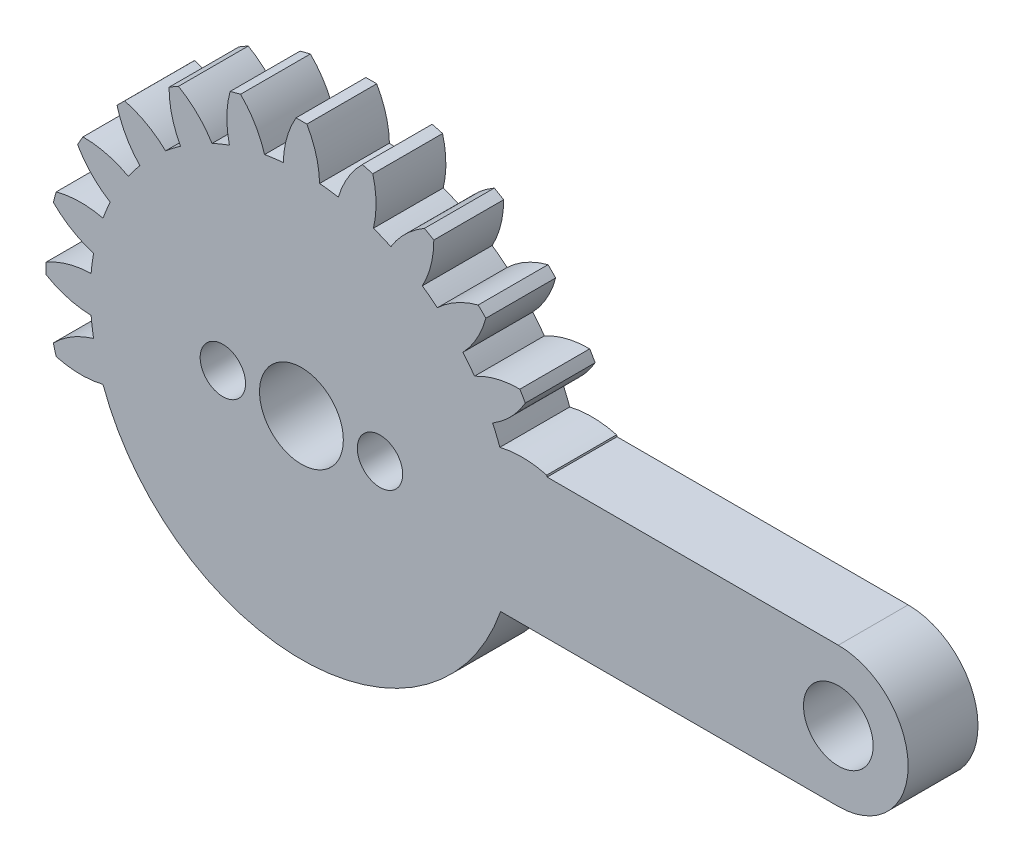
from build123d import *

# Parameters (mm, degrees)
SKETCH2_R           = 1.75
SKETCH2_R_2         = 1.995
BOSS_EXTRUDE1_DEPTH = 4
SKETCH4_R           = 1.3
SKETCH4_R_2         = 2.4
CUT_EXTRUDE1_DEPTH  = 38.915688046


with BuildPart() as part:
    # Sketch2 → Boss-Extrude1 (new body)
    with BuildSketch(Plane.XY):
        with BuildLine():
            ThreePointArc((30.75, -4), (34.75, 0), (30.75, 4))
            Line((30.75, 4), (14.072558403, 4))
            ThreePointArc((14.072558403, 4), (14.06038767, 4.04257326), (14.048088143, 4.085109489))
            ThreePointArc((14.048088143, 4.085109489), (12.709169027, 4.272836063), (11.365584201, 4.122086336))
            ThreePointArc((11.365584201, 4.122086336), (11.169703548, 4.626642697), (10.951436862, 5.12192646))
            ThreePointArc((10.951436862, 5.12192646), (12.008090957, 5.965388247), (12.82210701, 7.044889767))
            ThreePointArc((12.82210701, 7.044889767), (12.669951657, 7.315), (12.51210701, 7.581825517))
            ThreePointArc((12.51210701, 7.581825517), (11.170223244, 7.416617696), (9.911436862, 6.9232593))
            ThreePointArc((9.911436862, 6.9232593), (9.591641884, 7.359925677), (9.252623584, 7.781841479))
            ThreePointArc((9.252623584, 7.781841479), (10.05496909, 8.870045207), (10.561852666, 10.123446462))
            ThreePointArc((10.561852666, 10.123446462), (10.344972209, 10.344972209), (10.123446462, 10.561852666))
            ThreePointArc((10.123446462, 10.561852666), (8.870045207, 10.05496909), (7.781841479, 9.252623584))
            ThreePointArc((7.781841479, 9.252623584), (7.359925677, 9.591641884), (6.9232593, 9.911436862))
            ThreePointArc((6.9232593, 9.911436862), (7.416617696, 11.170223244), (7.581825517, 12.51210701))
            ThreePointArc((7.581825517, 12.51210701), (7.315, 12.669951657), (7.044889767, 12.82210701))
            ThreePointArc((7.044889767, 12.82210701), (5.965388247, 12.008090957), (5.12192646, 10.951436862))
            ThreePointArc((5.12192646, 10.951436862), (4.626642697, 11.169703548), (4.122086336, 11.365584201))
            ThreePointArc((4.122086336, 11.365584201), (4.272836063, 12.709169027), (4.085109489, 14.048088143))
            ThreePointArc((4.085109489, 14.048088143), (3.78652263, 14.131494839), (3.486235477, 14.208555951))
            ThreePointArc((3.486235477, 14.208555951), (2.654199937, 13.14288127), (2.112960617, 11.903927815))
            ThreePointArc((2.112960617, 11.903927815), (1.578061664, 11.986568374), (1.04, 12.04518576))
            ThreePointArc((1.04, 12.04518576), (0.837867713, 13.382005944), (0.31, 14.626715284))
            ThreePointArc((0.31, 14.626715284), (0, 14.63), (-0.31, 14.626715284))
            ThreePointArc((-0.31, 14.626715284), (-0.837867713, 13.382005944), (-1.04, 12.04518576))
            ThreePointArc((-1.04, 12.04518576), (-1.578061664, 11.986568374), (-2.112960617, 11.903927815))
            ThreePointArc((-2.112960617, 11.903927815), (-2.654199937, 13.14288127), (-3.486235477, 14.208555951))
            ThreePointArc((-3.486235477, 14.208555951), (-3.78652263, 14.131494839), (-4.085109489, 14.048088143))
            ThreePointArc((-4.085109489, 14.048088143), (-4.272836063, 12.709169027), (-4.122086336, 11.365584201))
            ThreePointArc((-4.122086336, 11.365584201), (-4.626642697, 11.169703548), (-5.12192646, 10.951436862))
            ThreePointArc((-5.12192646, 10.951436862), (-5.965388247, 12.008090957), (-7.044889767, 12.82210701))
            ThreePointArc((-7.044889767, 12.82210701), (-7.315, 12.669951657), (-7.581825517, 12.51210701))
            ThreePointArc((-7.581825517, 12.51210701), (-7.416617696, 11.170223244), (-6.9232593, 9.911436862))
            ThreePointArc((-6.9232593, 9.911436862), (-7.359925677, 9.591641884), (-7.781841479, 9.252623584))
            ThreePointArc((-7.781841479, 9.252623584), (-8.870045207, 10.05496909), (-10.123446462, 10.561852666))
            ThreePointArc((-10.123446462, 10.561852666), (-10.344972209, 10.344972209), (-10.561852666, 10.123446462))
            ThreePointArc((-10.561852666, 10.123446462), (-10.05496909, 8.870045207), (-9.252623584, 7.781841479))
            ThreePointArc((-9.252623584, 7.781841479), (-9.591641884, 7.359925677), (-9.911436862, 6.9232593))
            ThreePointArc((-9.911436862, 6.9232593), (-11.170223244, 7.416617696), (-12.51210701, 7.581825517))
            ThreePointArc((-12.51210701, 7.581825517), (-12.669951657, 7.315), (-12.82210701, 7.044889767))
            ThreePointArc((-12.82210701, 7.044889767), (-12.008090957, 5.965388247), (-10.951436862, 5.12192646))
            ThreePointArc((-10.951436862, 5.12192646), (-11.169703548, 4.626642697), (-11.365584201, 4.122086336))
            ThreePointArc((-11.365584201, 4.122086336), (-12.709169027, 4.272836063), (-14.048088143, 4.085109489))
            ThreePointArc((-14.048088143, 4.085109489), (-14.131494839, 3.78652263), (-14.208555951, 3.486235477))
            ThreePointArc((-14.208555951, 3.486235477), (-13.14288127, 2.654199937), (-11.903927815, 2.112960617))
            ThreePointArc((-11.903927815, 2.112960617), (-11.986568374, 1.578061664), (-12.04518576, 1.04))
            ThreePointArc((-12.04518576, 1.04), (-13.382005944, 0.837867713), (-14.626715284, 0.31))
            ThreePointArc((-14.626715284, 0.31), (-14.63, 0), (-14.626715284, -0.31))
            ThreePointArc((-14.626715284, -0.31), (-13.382005944, -0.837867713), (-12.04518576, -1.04))
            ThreePointArc((-12.04518576, -1.04), (-11.986568374, -1.578061664), (-11.903927815, -2.112960617))
            ThreePointArc((-11.903927815, -2.112960617), (-13.14288127, -2.654199937), (-14.208555951, -3.486235477))
            ThreePointArc((-14.208555951, -3.486235477), (-14.131494839, -3.78652263), (-14.048088143, -4.085109489))
            ThreePointArc((-14.048088143, -4.085109489), (-12.709169027, -4.272836063), (-11.365584201, -4.122086336))
            ThreePointArc((-11.365584201, -4.122086336), (0.064808849, -12.089826294), (11.409123542, -4))
            Line((11.409123542, -4), (30.75, -4))
        make_face()
        Circle(SKETCH2_R, mode=Mode.SUBTRACT)
        with Locations((30.75, 0)):
            Circle(SKETCH2_R_2, mode=Mode.SUBTRACT)
    extrude(amount=BOSS_EXTRUDE1_DEPTH)

    # Sketch4 → Cut-Extrude1 (cut, through all)
    with BuildSketch(Plane.XY.offset(4)):
        with Locations((4.5, 0)):
            Circle(SKETCH4_R)
        with Locations((-4.5, 0)):
            Circle(SKETCH4_R)
        Circle(SKETCH4_R_2)
    extrude(amount=-CUT_EXTRUDE1_DEPTH, mode=Mode.SUBTRACT)


solid = part.part
